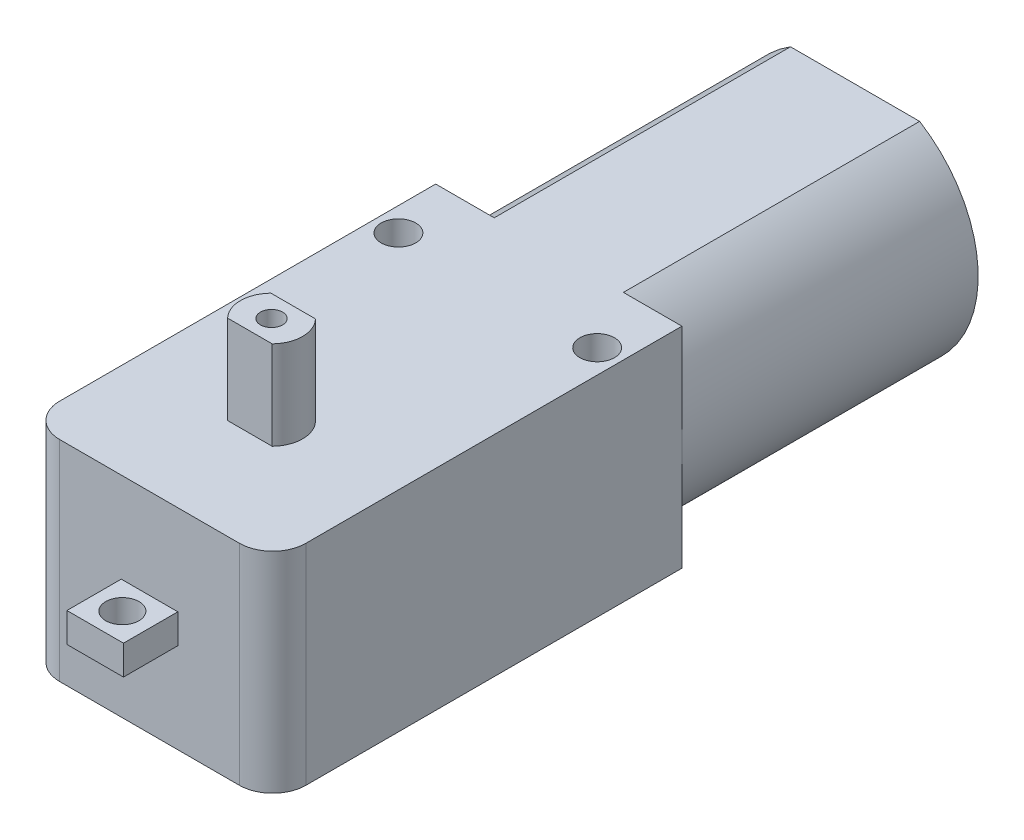
from build123d import *

# Parameters (mm, degrees)
SKETCH1_W           = 22.2
SKETCH1_H           = 18.9
BOSS_EXTRUDE1_DEPTH = 36.9
SKETCH2_W           = 5.1
SKETCH2_H           = 2.65
BOSS_EXTRUDE2_DEPTH = 4.9
BOSS_EXTRUDE3_DEPTH = 26.71
SKETCH4_R           = 1
BOSS_EXTRUDE4_DEPTH = 1
BOSS_EXTRUDE5_DEPTH = 8
BOSS_EXTRUDE6_START = 8
BOSS_EXTRUDE6_DEPTH = 8
SKETCH8_R           = 1.5
CUT_EXTRUDE1_DEPTH  = 71.850495588
SKETCH9_R           = 1
CUT_EXTRUDE2_DEPTH  = 77.715722639
SKETCH10_R          = 1.56
CUT_EXTRUDE3_DEPTH  = 74.422762819
FILLET1_R           = 3


with BuildPart() as part:
    # Sketch1 → Boss-Extrude1 (new body)
    with BuildSketch(Plane.XY):
        with Locations((11.1, 9.45)):
            Rectangle(SKETCH1_W, SKETCH1_H)
    extrude(amount=-BOSS_EXTRUDE1_DEPTH)

    # Sketch2 → Boss-Extrude2 (add)
    with BuildSketch(Plane.XY):
        with Locations((11.1, 9.45)):
            Rectangle(SKETCH2_W, SKETCH2_H)
    extrude(amount=BOSS_EXTRUDE2_DEPTH)

    # Sketch3 → Boss-Extrude3 (add)
    with BuildSketch(Plane(origin=(0, 0, -36.9), x_dir=(-1, 0, 0), z_dir=(0, 0, -1))):
        with BuildLine():
            Line((-16.923014683, 18.9), (-5.276985317, 18.9))
            ThreePointArc((-5.276985317, 18.9), (0, 9.45), (-5.276985317, 0))
            Line((-5.276985317, 0), (-16.923014683, 0))
            ThreePointArc((-16.923014683, 0), (-22.2, 9.45), (-16.923014683, 18.9))
        make_face()
    extrude(amount=BOSS_EXTRUDE3_DEPTH)

    # Sketch4 → Boss-Extrude4 (add)
    with BuildSketch(Plane(origin=(0, 0, -63.61), x_dir=(-1, 0, 0), z_dir=(0, 0, -1))):
        with Locations((-11.1, 9.45)):
            Circle(SKETCH4_R)
    extrude(amount=BOSS_EXTRUDE4_DEPTH)

    # Sketch5 → Boss-Extrude5 (add)
    with BuildSketch(Plane(origin=(0, 18.9, 0), x_dir=(1, 0, 0), z_dir=(0, 1, 0))):
        with BuildLine():
            Line((9.09064687, 12.95), (13.10935313, 12.95))
            ThreePointArc((13.10935313, 12.95), (13.9, 11), (13.10935313, 9.05))
            Line((13.10935313, 9.05), (9.09064687, 9.05))
            ThreePointArc((9.09064687, 9.05), (8.3, 11), (9.09064687, 12.95))
        make_face()
    extrude(amount=BOSS_EXTRUDE5_DEPTH)

    # Sketch6 → Boss-Extrude6 (add)
    with BuildSketch(Plane.XZ.offset(BOSS_EXTRUDE6_START)):
        with BuildLine():
            Line((9.09064687, -9.05), (13.10935313, -9.05))
            ThreePointArc((13.10935313, -9.05), (13.9, -11), (13.10935313, -12.95))
            Line((13.10935313, -12.95), (9.09064687, -12.95))
            ThreePointArc((9.09064687, -12.95), (8.3, -11), (9.09064687, -9.05))
        make_face()
    extrude(amount=-BOSS_EXTRUDE6_DEPTH)

    # Sketch8 → Cut-Extrude1 (cut, through all)
    with BuildSketch(Plane(origin=(0, 10.775, 0), x_dir=(1, 0, 0), z_dir=(0, 1, 0))):
        with Locations(Location((11.1, -2.45, 0), (0, 0, 270))):
            Circle(SKETCH8_R)
    extrude(amount=-CUT_EXTRUDE1_DEPTH, mode=Mode.SUBTRACT)

    # Sketch9 → Cut-Extrude2 (cut, through all)
    with BuildSketch(Plane(origin=(0, 26.9, 0), x_dir=(1, 0, 0), z_dir=(0, 1, 0))):
        with Locations(Location((11.1, 11, 0), (0, 0, 270))):
            Circle(SKETCH9_R)
    extrude(amount=-CUT_EXTRUDE2_DEPTH, mode=Mode.SUBTRACT)

    # Sketch10 → Cut-Extrude3 (cut, through all)
    with BuildSketch(Plane(origin=(0, 18.9, 0), x_dir=(1, 0, 0), z_dir=(0, 1, 0))):
        with Locations(Location((2.14, 31.4, 0), (0, 0, 270))):
            Circle(SKETCH10_R)
        with Locations(Location((20.06, 31.4, 0), (0, 0, 270))):
            Circle(SKETCH10_R)
    extrude(amount=-CUT_EXTRUDE3_DEPTH, mode=Mode.SUBTRACT)

    # Fillet1
    fillet1_edges = [part.edges().sort_by_distance(p)[0] for p in [
        (22.2, 9.45, 0),
        (0, 9.45, 0),
    ]]
    fillet(fillet1_edges, radius=FILLET1_R)


solid = part.part
